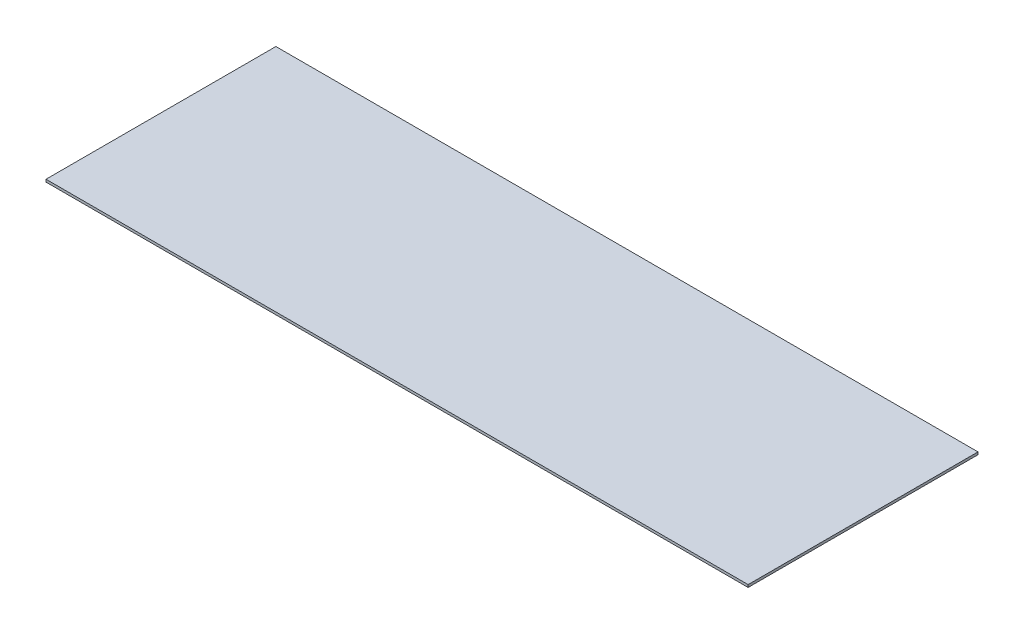
from build123d import *

# Parameters (mm, degrees)
SKETCH1_W           = 892.175
SKETCH1_H           = 292.1
BOSS_EXTRUDE1_DEPTH = 3.175


with BuildPart() as part:
    # Sketch1 → Boss-Extrude1 (new body)
    with BuildSketch(Plane(origin=(0, 0, 0), x_dir=(1, 0, 0), z_dir=(0, 1, 0))):
        Rectangle(SKETCH1_W, SKETCH1_H)
    extrude(amount=BOSS_EXTRUDE1_DEPTH)


solid = part.part
